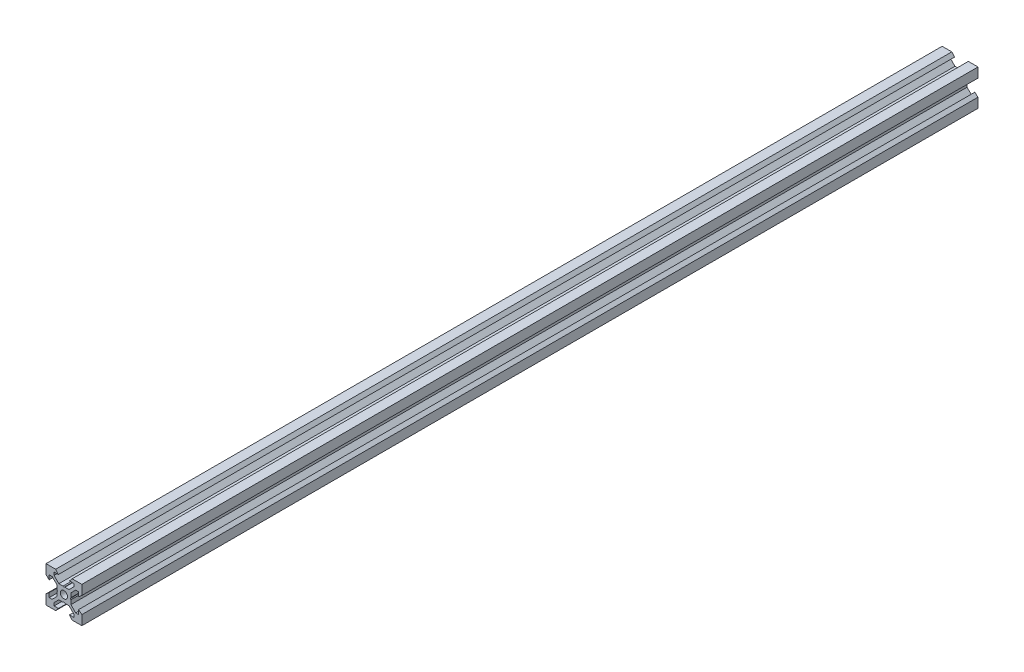
from build123d import *

# Parameters (mm, degrees)
SKETCH1_R           = 2
BOSS_EXTRUDE1_DEPTH = 250


with BuildPart() as part:
    # Sketch1 → Boss-Extrude1 (new, symmetric)
    with BuildSketch(Plane.XY):
        Polygon((10, 10), (10, 4.610379336), (8.2, 3.1), (8.2, 5.5), (6.560660172, 5.5), (3.9, 2.839339828), (3.9, 0.519615242), (3.6, 0), (3.9, -0.519615242), (3.9, -2.839339828), (6.560660172, -5.5), (8.2, -5.5), (8.2, -3.1), (10, -4.610379336), (10, -10), (4.610379336, -10), (3.1, -8.2), (5.5, -8.2), (5.5, -6.560660172), (2.839339828, -3.9), (0.519615242, -3.9), (0, -3.6), (-0.519615242, -3.9), (-2.839339828, -3.9), (-5.5, -6.560660172), (-5.5, -8.2), (-3.1, -8.2), (-4.610379336, -10), (-10, -10), (-10, -4.610379336), (-8.2, -3.1), (-8.2, -5.5), (-6.560660172, -5.5), (-3.9, -2.839339828), (-3.9, -0.519615242), (-3.6, 0), (-3.9, 0.519615242), (-3.9, 2.839339828), (-6.560660172, 5.5), (-8.2, 5.5), (-8.2, 3.1), (-10, 4.610379336), (-10, 10), (-4.610379336, 10), (-3.1, 8.2), (-5.5, 8.2), (-5.5, 6.560660172), (-2.839339828, 3.9), (-0.519615242, 3.9), (0, 3.6), (0.519615242, 3.9), (2.839339828, 3.9), (5.5, 6.560660172), (5.5, 8.2), (3.1, 8.2), (4.610379336, 10), align=None)
        Circle(SKETCH1_R, mode=Mode.SUBTRACT)
    extrude(amount=BOSS_EXTRUDE1_DEPTH, both=True)


solid = part.part
